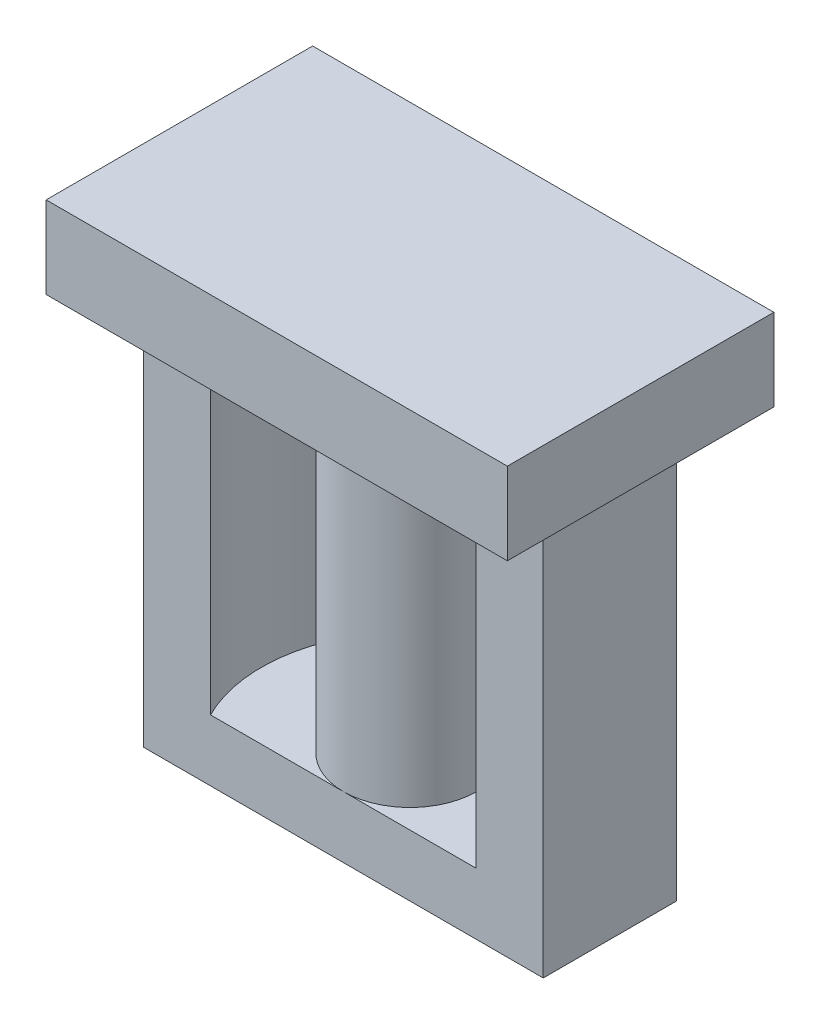
from build123d import *

# Parameters (mm, degrees)
EXTRUDE_1_DEPTH   = 14
SKETCH_1_R        = 6.5
EXTRUDE_1_2_DEPTH = 14
EXTRUDE_1_3_DEPTH = 14
SKETCH_2_W        = 39
SKETCH_2_H        = 13
EXTRUDE_2_DEPTH   = 6
SKETCH_3_R        = 6.5
EXTRUDE_3_DEPTH   = 14
SKETCH_4_W        = 39
SKETCH_4_H        = 13
EXTRUDE_4_DEPTH   = 6
SKETCH_5_W        = 45
SKETCH_5_H        = 26
EXTRUDE_5_DEPTH   = 8


with BuildPart() as part:
    # Эскиз1 → Бобышка-Вытянуть1 (new body)
    with BuildSketch(Plane(origin=(0, 0, 0), x_dir=(1, 0, 0), z_dir=(0, 1, 0))):
        with BuildLine():
            Line((0, 13), (0, 0))
            Line((0, 0), (6.538518603, 0))
            ThreePointArc((6.538518603, 0), (5, 6.5), (6.538518603, 13))
            Line((6.538518603, 13), (0, 13))
        make_face()
    extrude(amount=EXTRUDE_1_DEPTH)



with BuildPart() as body_2:
    # Эскиз1 → Extrude 1 2 (new body)
    with BuildSketch(Plane(origin=(0, 0, 0), x_dir=(1, 0, 0), z_dir=(0, 1, 0))):
        with Locations(Location((19.5, 6.5, 0), (0, 0, 270))):
            Circle(SKETCH_1_R)
    extrude(amount=EXTRUDE_1_2_DEPTH)


with BuildPart() as body_3:
    # Эскиз1 → Extrude 1 3 (new body)
    with BuildSketch(Plane(origin=(0, 0, 0), x_dir=(1, 0, 0), z_dir=(0, 1, 0))):
        with BuildLine():
            ThreePointArc((34, 6.5), (33.61012899, 3.160200624), (32.461481397, 0))
            Line((32.461481397, 0), (39, 0))
            Line((39, 0), (39, 13))
            Line((39, 13), (32.461481397, 13))
            ThreePointArc((32.461481397, 13), (33.61012899, 9.839799376), (34, 6.5))
        make_face()
    extrude(amount=EXTRUDE_1_3_DEPTH)


with BuildPart() as part_1:
    add(part.part)

    add(body_2.part)  # Бобышка-Вытянуть2 merges body 2

    add(body_3.part)  # Бобышка-Вытянуть2 merges body 3
    # Эскиз2 → Бобышка-Вытянуть2 (add)
    with BuildSketch(Plane.XZ):
        with Locations((19.5, -6.5)):
            Rectangle(SKETCH_2_W, SKETCH_2_H)
    extrude(amount=EXTRUDE_2_DEPTH)

    # Эскиз3 → Бобышка-Вытянуть3 (add)
    with BuildSketch(Plane(origin=(0, 14, 0), x_dir=(1, 0, 0), z_dir=(0, 1, 0))):
        with Locations(Location((19.5, 6.5, 0), (0, 0, 270))):
            Circle(SKETCH_3_R)
        with BuildLine():
            Line((32.461481397, 0), (39, 0))
            Line((39, 0), (39, 13))
            Line((39, 13), (32.461481397, 13))
            ThreePointArc((32.461481397, 13), (34, 6.5), (32.461481397, 0))
        make_face()
        with BuildLine():
            Line((6.538518603, 13), (0, 13))
            Line((0, 13), (0, 0))
            Line((0, 0), (6.538518603, 0))
            ThreePointArc((6.538518603, 0), (5, 6.5), (6.538518603, 13))
        make_face()
    extrude(amount=EXTRUDE_3_DEPTH)

    # Эскиз4 → Бобышка-Вытянуть4 (add)
    with BuildSketch(Plane(origin=(0, 28, 0), x_dir=(1, 0, 0), z_dir=(0, 1, 0))):
        with Locations((19.5, 6.5)):
            Rectangle(SKETCH_4_W, SKETCH_4_H)
    extrude(amount=EXTRUDE_4_DEPTH)

    # Эскиз5 → Бобышка-Вытянуть5 (add)
    with BuildSketch(Plane(origin=(0, 34, 0), x_dir=(1, 0, 0), z_dir=(0, 1, 0))):
        with Locations((19.5, 6.5)):
            Rectangle(SKETCH_5_W, SKETCH_5_H)
    extrude(amount=EXTRUDE_5_DEPTH)


solid = part_1.part
